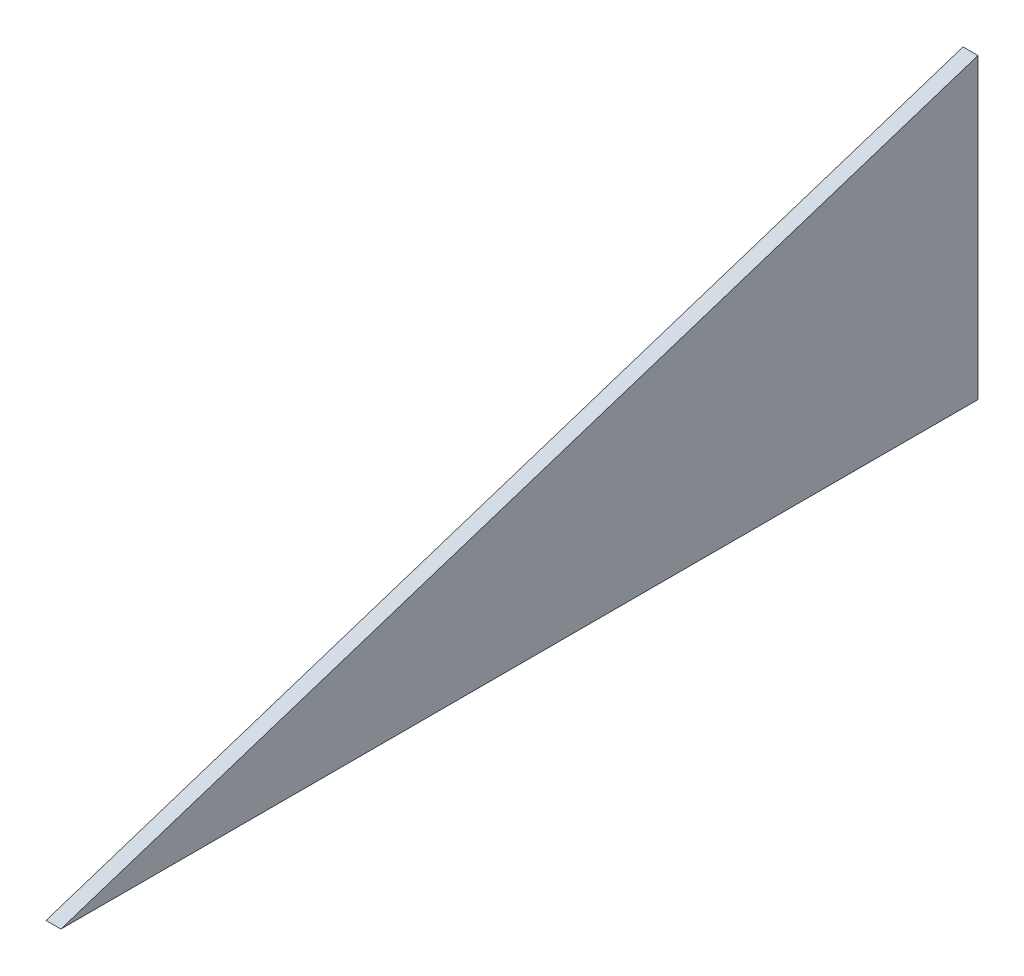
from build123d import *

# Parameters (mm, degrees)
BOSS_EXTRUDE1_DEPTH = 5


with BuildPart() as part:
    # Sketch1 → Boss-Extrude1 (new body)
    with BuildSketch(Plane(origin=(0, 0, 0), x_dir=(0, 0, -1), z_dir=(1, 0, 0))):
        Polygon((0, 0), (307.768353718, 100), (307.768353718, 0), align=None)
    extrude(amount=BOSS_EXTRUDE1_DEPTH)


solid = part.part
